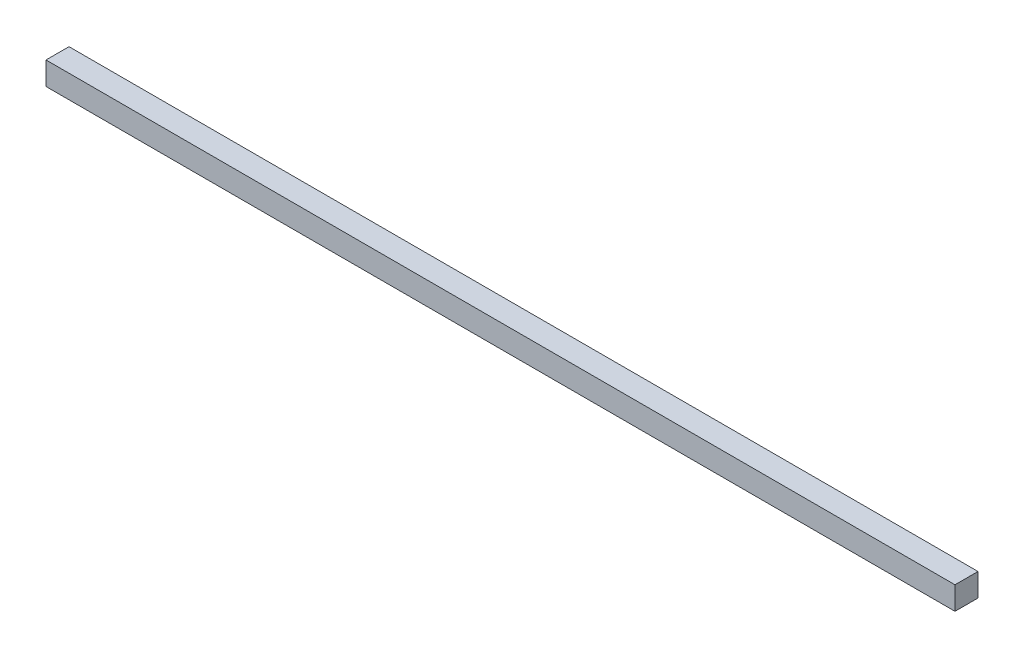
from build123d import *

# Parameters (mm, degrees)
SKETCH1_W      = 250.825
SKETCH1_H      = 6.35
EXTRUDE1_DEPTH = 6.35


with BuildPart() as part:
    # Sketch1 → Extrude1 (new body)
    with BuildSketch(Plane.XY):
        with Locations((125.4125, 3.175)):
            Rectangle(SKETCH1_W, SKETCH1_H)
    extrude(amount=EXTRUDE1_DEPTH)


solid = part.part
